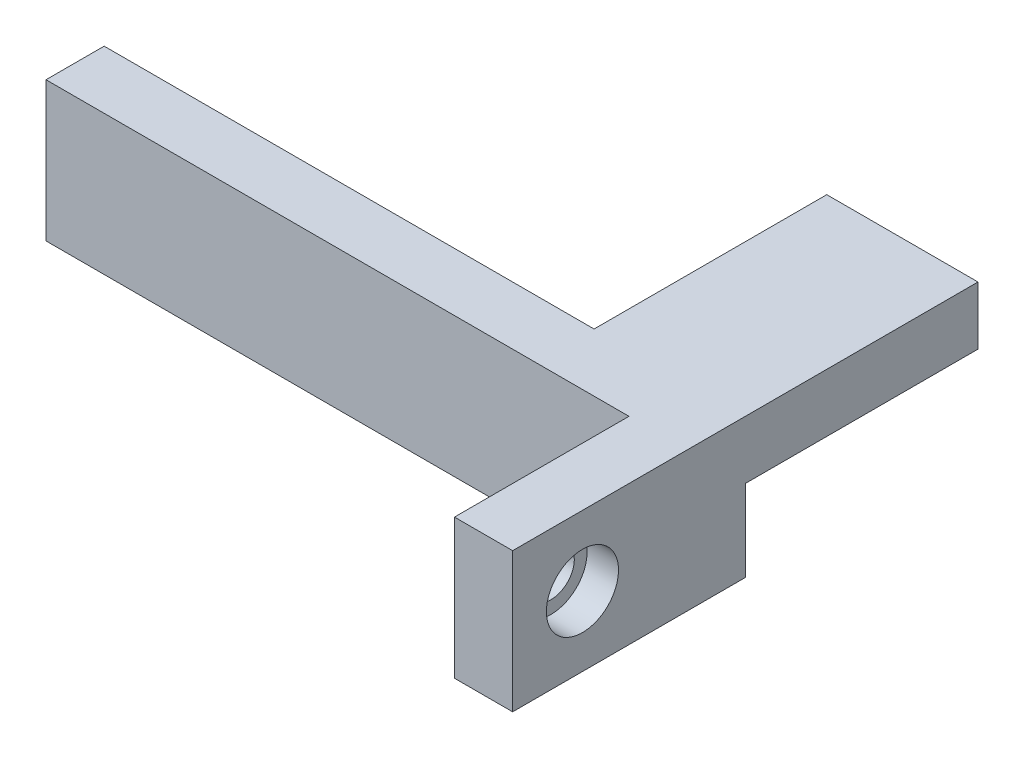
from build123d import *

# Parameters (mm, degrees)
SKETCH_1_W          = 42.110617321
SKETCH_1_H          = 5
EXTRUDE_1_DEPTH     = 5
SKETCH_2_W          = 13
SKETCH_2_H          = 5
EXTRUDE_2_DEPTH     = 25
SKETCH_2_3_W        = 5
SKETCH_2_3_H        = 5
EXTRUDE_3_DEPTH     = 15
SKETCH_3_W          = 5
SKETCH_3_H          = 15
EXTRUDE_4_DEPTH     = 7
SKETCH_4_R          = 2
CUT_EXTRUDE_1_DEPTH = 61.919456182
SKETCH_4_3_R        = 3.1
CUT_EXTRUDE_2_DEPTH = 2.7


with BuildPart() as part:
    # 草图1 → 凸台-拉伸1 (new body)
    with BuildSketch(Plane(origin=(0, 0, 0), x_dir=(1, 0, 0), z_dir=(0, 1, 0))):
        with Locations((-21.05530866, 2.5)):
            Rectangle(SKETCH_1_W, SKETCH_1_H)
    extrude(amount=EXTRUDE_1_DEPTH)

    # 草图2 → 凸台-拉伸2 (add)
    with BuildSketch(Plane(origin=(0, 0, 0), x_dir=(-1, 0, 0), z_dir=(0, 0, -1))):
        with Locations((-6.5, 2.5)):
            Rectangle(SKETCH_2_W, SKETCH_2_H)
    extrude(amount=EXTRUDE_2_DEPTH)

    # 草图2<3> → 凸台-拉伸3 (add)
    with BuildSketch(Plane(origin=(0, 0, 0), x_dir=(-1, 0, 0), z_dir=(0, 0, -1))):
        with Locations((-10.5, 2.5)):
            Rectangle(SKETCH_2_3_W, SKETCH_2_3_H)
    extrude(amount=-EXTRUDE_3_DEPTH)

    # 草图3 → 凸台-拉伸4 (add)
    with BuildSketch(Plane.XZ):
        Polygon((8, 0), (-42.110617321, 0), (-42.110617321, -5), (13, -5), (13, 0), align=None)
        with Locations((10.5, 7.5)):
            Rectangle(SKETCH_3_W, SKETCH_3_H)
    extrude(amount=EXTRUDE_4_DEPTH)

    # 草图4 → 切除-拉伸1 (cut, through all)
    with BuildSketch(Plane(origin=(13, 0, 0), x_dir=(0, 0, -1), z_dir=(1, 0, 0))):
        with Locations((-9, -1)):
            Circle(SKETCH_4_R)
    extrude(amount=-CUT_EXTRUDE_1_DEPTH, mode=Mode.SUBTRACT)

    # 草图4<3> → 切除-拉伸2 (cut)
    with BuildSketch(Plane(origin=(13, 0, 0), x_dir=(0, 0, -1), z_dir=(1, 0, 0))):
        with Locations((-9, -1)):
            Circle(SKETCH_4_3_R)
    extrude(amount=-CUT_EXTRUDE_2_DEPTH, mode=Mode.SUBTRACT)


solid = part.part
